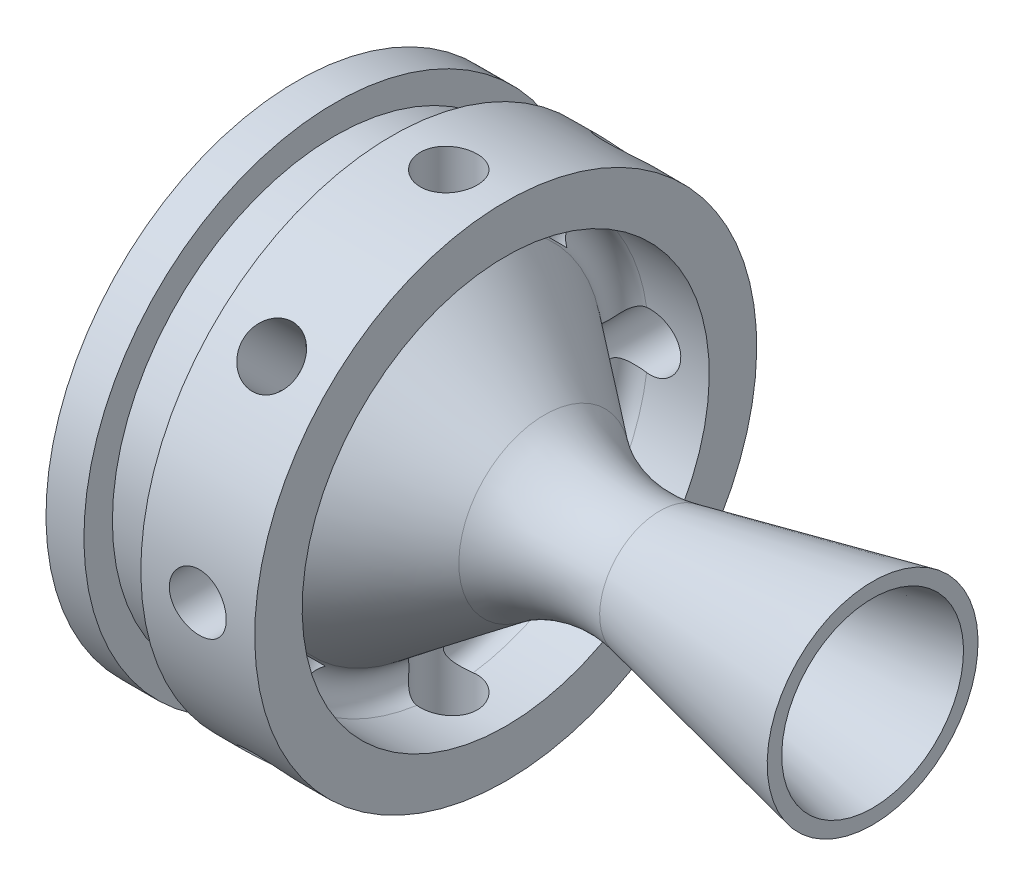
from build123d import *

# Parameters (mm, degrees)
SKETCH4_R          = 3
CUT_EXTRUDE2_DEPTH = 80
CIRPATTERN2_COUNT  = 8


with BuildPart() as part:
    # Sketch1 → Revolve1 (revolve)
    with BuildSketch(Plane.XY):
        with BuildLine():
            Line((1.039558454, 3.376362491), (30.215261354, 9.577849584))
            Line((30.215261354, 9.577849584), (30.215261354, 11.111360476))
            Line((30.215261354, 11.111360476), (7.798105088, 6.346446818))
            ThreePointArc((7.798105088, 6.346446818), (1.432835517, 6.374220722), (-4.347795622, 9.039128178))
            Line((-4.347795622, 9.039128178), (-16.043838926, 17.85272898))
            ThreePointArc((-16.043838926, 17.85272898), (-16.73685619, 20.084609313), (-14.840208879, 21.45))
            Line((-14.840208879, 21.45), (-8.447156104, 21.45))
            Line((-8.447156104, 21.45), (-8.447156104, 26.45))
            Line((-8.447156104, 26.45), (-20.447156104, 26.45))
            Line((-20.447156104, 26.45), (-20.447156104, 23.45))
            Line((-20.447156104, 23.45), (-26.447156104, 23.45))
            Line((-26.447156104, 23.45), (-26.447156104, 26.45))
            Line((-26.447156104, 26.45), (-30.447156104, 26.45))
            Line((-30.447156104, 26.45), (-30.447156104, 24.95))
            Line((-30.447156104, 24.95), (-3.009075116, 4.273922944))
            ThreePointArc((-3.009075116, 4.273922944), (-1.08219807, 3.385620459), (1.039558454, 3.376362491))
        make_face()
    revolve(axis=Axis((-30.447156104, 0, 0), (1, 0, 0)))

    # Sketch4 → Cut-Extrude2 (cut)
    with BuildSketch(Plane(origin=(0, 18, 0), x_dir=(-1, 0, 0), z_dir=(0, 1, 0))):
        with Locations((14.447156104, 0)):
            Circle(SKETCH4_R)
    cut_extrude2 = extrude(amount=CUT_EXTRUDE2_DEPTH, mode=Mode.SUBTRACT)

    # CirPattern2: Cut-Extrude2 ×8 about axis
    cirpattern2_axis = Axis((-38.981134422, 0, 0), (1, 0, 0))
    for i in range(1, CIRPATTERN2_COUNT):
        add(cut_extrude2.rotate(cirpattern2_axis, i * 360 / CIRPATTERN2_COUNT), mode=Mode.SUBTRACT)


solid = part.part
